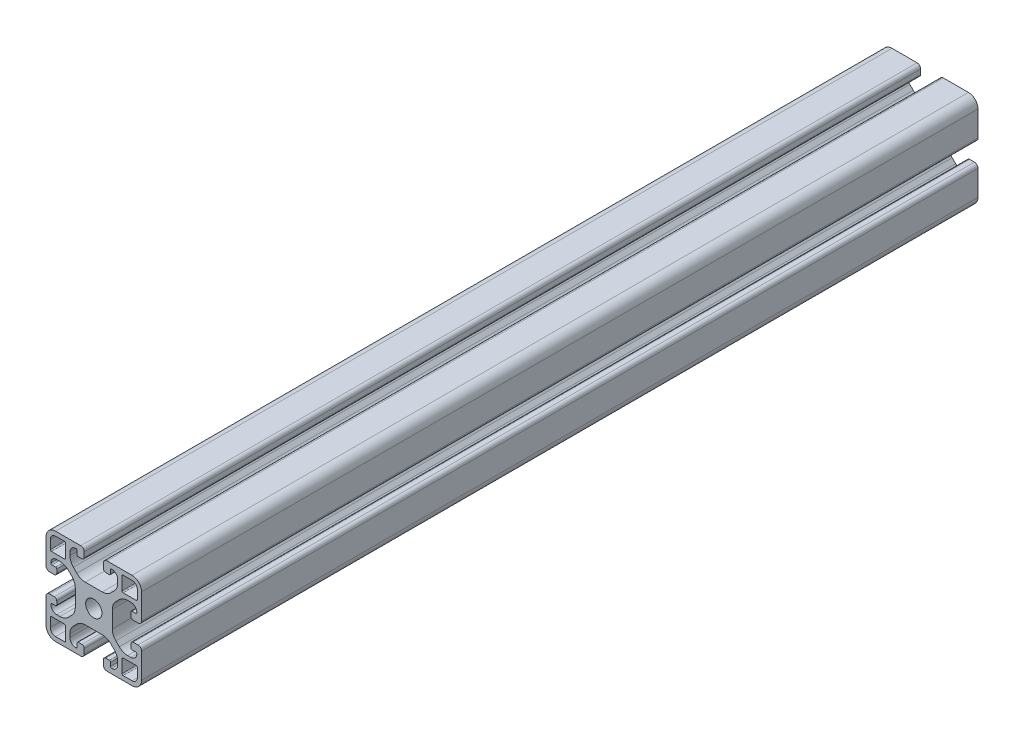
from build123d import *

# Parameters (mm, degrees)
ESQUISSE1_R        = 3.4
BOSS_EXTRU_1_DEPTH = 350


with BuildPart() as part:
    # Esquisse1 → Boss.-Extru.1 (new body)
    with BuildSketch(Plane(origin=(0, 0, -30), x_dir=(-1, 0, 0), z_dir=(0, 0, -1))):
        with BuildLine():
            Line((-4.5, 15), (-4.5, 13.5))
            ThreePointArc((-4.5, 13.5), (-4.353553391, 13.146446609), (-4, 13))
            Line((-4, 13), (-2.5, 13))
            ThreePointArc((-2.5, 13), (-2.146446609, 12.853553391), (-2, 12.5))
            ThreePointArc((-2, 12.5), (-2.732233047, 10.732233047), (-4.5, 10))
            Line((-4.5, 10), (-5.807611845, 10))
            ThreePointArc((-5.807611845, 10), (-7.721029006, 10.380602337), (-9.343145751, 11.464466094))
            Line((-9.343145751, 11.464466094), (-10.785533906, 12.906854249))
            ThreePointArc((-10.785533906, 12.906854249), (-11.869397663, 14.528970994), (-12.25, 16.442388155))
            Line((-12.25, 16.442388155), (-12.25, 23.557611845))
            ThreePointArc((-12.25, 23.557611845), (-11.869397663, 25.471029006), (-10.785533906, 27.093145751))
            Line((-10.785533906, 27.093145751), (-9.343145751, 28.535533906))
            ThreePointArc((-9.343145751, 28.535533906), (-7.721029006, 29.619397663), (-5.807611845, 30))
            Line((-5.807611845, 30), (-4.5, 30))
            ThreePointArc((-4.5, 30), (-2.732233047, 29.267766953), (-2, 27.5))
            ThreePointArc((-2, 27.5), (-2.146446609, 27.146446609), (-2.5, 27))
            Line((-2.5, 27), (-4, 27))
            ThreePointArc((-4, 27), (-4.353553391, 26.853553391), (-4.5, 26.5))
            Line((-4.5, 26.5), (-4.5, 25))
            ThreePointArc((-4.5, 25), (-4.207106781, 24.292893219), (-3.5, 24))
            Line((-3.5, 24), (-1.5, 24))
            ThreePointArc((-1.5, 24), (-0.439339828, 24.439339828), (0, 25.5))
            Line((0, 25.5), (0, 36))
            ThreePointArc((0, 36), (-1.171572875, 38.828427125), (-4, 40))
            Line((-4, 40), (-14.5, 40))
            ThreePointArc((-14.5, 40), (-15.560660172, 39.560660172), (-16, 38.5))
            Line((-16, 38.5), (-16, 36.5))
            ThreePointArc((-16, 36.5), (-15.707106781, 35.792893219), (-15, 35.5))
            Line((-15, 35.5), (-13.5, 35.5))
            ThreePointArc((-13.5, 35.5), (-13.146446609, 35.646446609), (-13, 36))
            Line((-13, 36), (-13, 37.5))
            ThreePointArc((-13, 37.5), (-12.853553391, 37.853553391), (-12.5, 38))
            ThreePointArc((-12.5, 38), (-10.732233047, 37.267766953), (-10, 35.5))
            Line((-10, 35.5), (-10, 34.192388155))
            ThreePointArc((-10, 34.192388155), (-10.380602337, 32.278970994), (-11.464466094, 30.656854249))
            Line((-11.464466094, 30.656854249), (-12.906854249, 29.214466094))
            ThreePointArc((-12.906854249, 29.214466094), (-14.528970994, 28.130602337), (-16.442388155, 27.75))
            Line((-16.442388155, 27.75), (-23.557611845, 27.75))
            ThreePointArc((-23.557611845, 27.75), (-25.471029006, 28.130602337), (-27.093145751, 29.214466094))
            Line((-27.093145751, 29.214466094), (-28.535533906, 30.656854249))
            ThreePointArc((-28.535533906, 30.656854249), (-29.619397663, 32.278970994), (-30, 34.192388155))
            Line((-30, 34.192388155), (-30, 35.5))
            ThreePointArc((-30, 35.5), (-29.267766953, 37.267766953), (-27.5, 38))
            ThreePointArc((-27.5, 38), (-27.146446609, 37.853553391), (-27, 37.5))
            Line((-27, 37.5), (-27, 36))
            ThreePointArc((-27, 36), (-26.853553391, 35.646446609), (-26.5, 35.5))
            Line((-26.5, 35.5), (-25, 35.5))
            ThreePointArc((-25, 35.5), (-24.292893219, 35.792893219), (-24, 36.5))
            Line((-24, 36.5), (-24, 38.5))
            ThreePointArc((-24, 38.5), (-24.439339828, 39.560660172), (-25.5, 40))
            Line((-25.5, 40), (-36, 40))
            ThreePointArc((-36, 40), (-38.828427125, 38.828427125), (-40, 36))
            Line((-40, 36), (-40, 25.5))
            ThreePointArc((-40, 25.5), (-39.560660172, 24.439339828), (-38.5, 24))
            Line((-38.5, 24), (-36.5, 24))
            ThreePointArc((-36.5, 24), (-35.792893219, 24.292893219), (-35.5, 25))
            Line((-35.5, 25), (-35.5, 26.5))
            ThreePointArc((-35.5, 26.5), (-35.646446609, 26.853553391), (-36, 27))
            Line((-36, 27), (-37.5, 27))
            ThreePointArc((-37.5, 27), (-37.853553391, 27.146446609), (-38, 27.5))
            ThreePointArc((-38, 27.5), (-37.267766953, 29.267766953), (-35.5, 30))
            Line((-35.5, 30), (-34.192388155, 30))
            ThreePointArc((-34.192388155, 30), (-32.278970994, 29.619397663), (-30.656854249, 28.535533906))
            Line((-30.656854249, 28.535533906), (-29.214466094, 27.093145751))
            ThreePointArc((-29.214466094, 27.093145751), (-28.130602337, 25.471029006), (-27.75, 23.557611845))
            Line((-27.75, 23.557611845), (-27.75, 16.442388155))
            ThreePointArc((-27.75, 16.442388155), (-28.130602337, 14.528970994), (-29.214466094, 12.906854249))
            Line((-29.214466094, 12.906854249), (-30.656854249, 11.464466094))
            ThreePointArc((-30.656854249, 11.464466094), (-32.278970994, 10.380602337), (-34.192388155, 10))
            Line((-34.192388155, 10), (-35.5, 10))
            ThreePointArc((-35.5, 10), (-37.267766953, 10.732233047), (-38, 12.5))
            ThreePointArc((-38, 12.5), (-37.853553391, 12.853553391), (-37.5, 13))
            Line((-37.5, 13), (-36, 13))
            ThreePointArc((-36, 13), (-35.646446609, 13.146446609), (-35.5, 13.5))
            Line((-35.5, 13.5), (-35.5, 15))
            ThreePointArc((-35.5, 15), (-35.792893219, 15.707106781), (-36.5, 16))
            Line((-36.5, 16), (-38.5, 16))
            ThreePointArc((-38.5, 16), (-39.560660172, 15.560660172), (-40, 14.5))
            Line((-40, 14.5), (-40, 4))
            ThreePointArc((-40, 4), (-38.828427125, 1.171572875), (-36, 0))
            Line((-36, 0), (-25.5, 0))
            ThreePointArc((-25.5, 0), (-24.439339828, 0.439339828), (-24, 1.5))
            Line((-24, 1.5), (-24, 3.5))
            ThreePointArc((-24, 3.5), (-24.292893219, 4.207106781), (-25, 4.5))
            Line((-25, 4.5), (-26.5, 4.5))
            ThreePointArc((-26.5, 4.5), (-26.853553391, 4.353553391), (-27, 4))
            Line((-27, 4), (-27, 2.5))
            ThreePointArc((-27, 2.5), (-27.146446609, 2.146446609), (-27.5, 2))
            ThreePointArc((-27.5, 2), (-29.267766953, 2.732233047), (-30, 4.5))
            Line((-30, 4.5), (-30, 5.807611845))
            ThreePointArc((-30, 5.807611845), (-29.619397663, 7.721029006), (-28.535533906, 9.343145751))
            Line((-28.535533906, 9.343145751), (-27.093145751, 10.785533906))
            ThreePointArc((-27.093145751, 10.785533906), (-25.471029006, 11.869397663), (-23.557611845, 12.25))
            Line((-23.557611845, 12.25), (-16.442388155, 12.25))
            ThreePointArc((-16.442388155, 12.25), (-14.528970994, 11.869397663), (-12.906854249, 10.785533906))
            Line((-12.906854249, 10.785533906), (-11.464466094, 9.343145751))
            ThreePointArc((-11.464466094, 9.343145751), (-10.380602337, 7.721029006), (-10, 5.807611845))
            Line((-10, 5.807611845), (-10, 4.5))
            ThreePointArc((-10, 4.5), (-10.732233047, 2.732233047), (-12.5, 2))
            ThreePointArc((-12.5, 2), (-12.853553391, 2.146446609), (-13, 2.5))
            Line((-13, 2.5), (-13, 4))
            ThreePointArc((-13, 4), (-13.146446609, 4.353553391), (-13.5, 4.5))
            Line((-13.5, 4.5), (-15, 4.5))
            ThreePointArc((-15, 4.5), (-15.707106781, 4.207106781), (-16, 3.5))
            Line((-16, 3.5), (-16, 1.5))
            ThreePointArc((-16, 1.5), (-15.560660172, 0.439339828), (-14.5, 0))
            Line((-14.5, 0), (-4, 0))
            ThreePointArc((-4, 0), (-1.171572875, 1.171572875), (0, 4))
            Line((0, 4), (0, 14.5))
            ThreePointArc((0, 14.5), (-0.439339828, 15.560660172), (-1.5, 16))
            Line((-1.5, 16), (-3.5, 16))
            ThreePointArc((-3.5, 16), (-4.207106781, 15.707106781), (-4.5, 15))
        make_face()
        with Locations(Location((-20, 20, 0), (0, 0, 180))):
            Circle(ESQUISSE1_R, mode=Mode.SUBTRACT)
        with BuildLine():
            Line((-4, 1.8), (-7.7, 1.8))
            ThreePointArc((-7.7, 1.8), (-8.053553391, 1.946446609), (-8.2, 2.3))
            Line((-8.2, 2.3), (-8.2, 7.7))
            ThreePointArc((-8.2, 7.7), (-8.053553391, 8.053553391), (-7.7, 8.2))
            Line((-7.7, 8.2), (-2.3, 8.2))
            ThreePointArc((-2.3, 8.2), (-1.946446609, 8.053553391), (-1.8, 7.7))
            Line((-1.8, 7.7), (-1.8, 4))
            ThreePointArc((-1.8, 4), (-2.444365081, 2.444365081), (-4, 1.8))
        make_face(mode=Mode.SUBTRACT)
        with BuildLine():
            Line((-38.2, 4), (-38.2, 7.7))
            ThreePointArc((-38.2, 7.7), (-38.053553391, 8.053553391), (-37.7, 8.2))
            Line((-37.7, 8.2), (-32.3, 8.2))
            ThreePointArc((-32.3, 8.2), (-31.946446609, 8.053553391), (-31.8, 7.7))
            Line((-31.8, 7.7), (-31.8, 2.3))
            ThreePointArc((-31.8, 2.3), (-31.946446609, 1.946446609), (-32.3, 1.8))
            Line((-32.3, 1.8), (-36, 1.8))
            ThreePointArc((-36, 1.8), (-37.555634919, 2.444365081), (-38.2, 4))
        make_face(mode=Mode.SUBTRACT)
        with BuildLine():
            Line((-36, 38.2), (-32.3, 38.2))
            ThreePointArc((-32.3, 38.2), (-31.946446609, 38.053553391), (-31.8, 37.7))
            Line((-31.8, 37.7), (-31.8, 32.3))
            ThreePointArc((-31.8, 32.3), (-31.946446609, 31.946446609), (-32.3, 31.8))
            Line((-32.3, 31.8), (-37.7, 31.8))
            ThreePointArc((-37.7, 31.8), (-38.053553391, 31.946446609), (-38.2, 32.3))
            Line((-38.2, 32.3), (-38.2, 36))
            ThreePointArc((-38.2, 36), (-37.555634919, 37.555634919), (-36, 38.2))
        make_face(mode=Mode.SUBTRACT)
        with BuildLine():
            Line((-1.8, 36), (-1.8, 32.3))
            ThreePointArc((-1.8, 32.3), (-1.946446609, 31.946446609), (-2.3, 31.8))
            Line((-2.3, 31.8), (-7.7, 31.8))
            ThreePointArc((-7.7, 31.8), (-8.053553391, 31.946446609), (-8.2, 32.3))
            Line((-8.2, 32.3), (-8.2, 37.7))
            ThreePointArc((-8.2, 37.7), (-8.053553391, 38.053553391), (-7.7, 38.2))
            Line((-7.7, 38.2), (-4, 38.2))
            ThreePointArc((-4, 38.2), (-2.444365081, 37.555634919), (-1.8, 36))
        make_face(mode=Mode.SUBTRACT)
    extrude(amount=-BOSS_EXTRU_1_DEPTH)


solid = part.part
